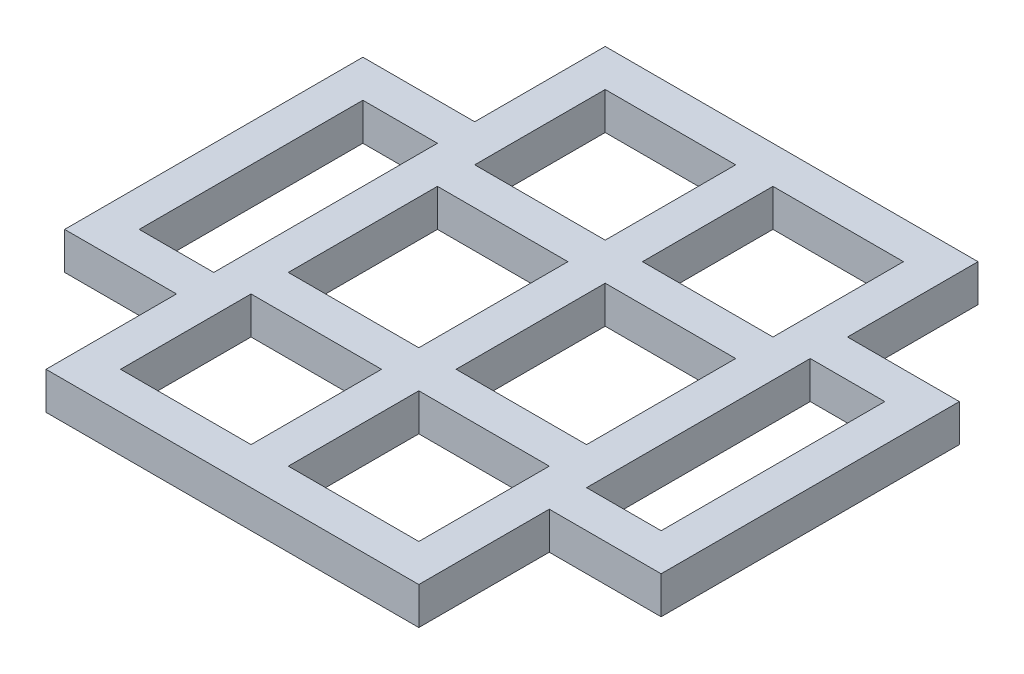
from build123d import *

# Parameters (mm, degrees)
SKETCH4_W           = 70
SKETCH4_H           = 70
SKETCH4_H_2         = 80
SKETCH4_W_2         = 40
SKETCH4_H_3         = 120
BOSS_EXTRUDE2_DEPTH = 20


with BuildPart() as part:
    # Sketch4 → Boss-Extrude2 (new body)
    with BuildSketch(Plane(origin=(0, 0, 0), x_dir=(1, 0, 0), z_dir=(0, 1, 0))):
        Polygon((-100, 150), (100, 150), (100, 80), (160, 80), (160, -80), (100, -80), (100, -150), (-100, -150), (-100, -80), (-160, -80), (-160, 80), (-100, 80), align=None)
        with Locations((-45, 95)):
            Rectangle(SKETCH4_W, SKETCH4_H, mode=Mode.SUBTRACT)
        with Locations((45, 95)):
            Rectangle(SKETCH4_W, SKETCH4_H, mode=Mode.SUBTRACT)
        with Locations((-45, 0)):
            Rectangle(SKETCH4_W, SKETCH4_H_2, mode=Mode.SUBTRACT)
        with Locations((45, 0)):
            Rectangle(SKETCH4_W, SKETCH4_H_2, mode=Mode.SUBTRACT)
        with Locations((-45, -95)):
            Rectangle(SKETCH4_W, SKETCH4_H, mode=Mode.SUBTRACT)
        with Locations((45, -95)):
            Rectangle(SKETCH4_W, SKETCH4_H, mode=Mode.SUBTRACT)
        with Locations((120, 0)):
            Rectangle(SKETCH4_W_2, SKETCH4_H_3, mode=Mode.SUBTRACT)
        with Locations((-120, 0)):
            Rectangle(SKETCH4_W_2, SKETCH4_H_3, mode=Mode.SUBTRACT)
    extrude(amount=BOSS_EXTRUDE2_DEPTH)


solid = part.part
